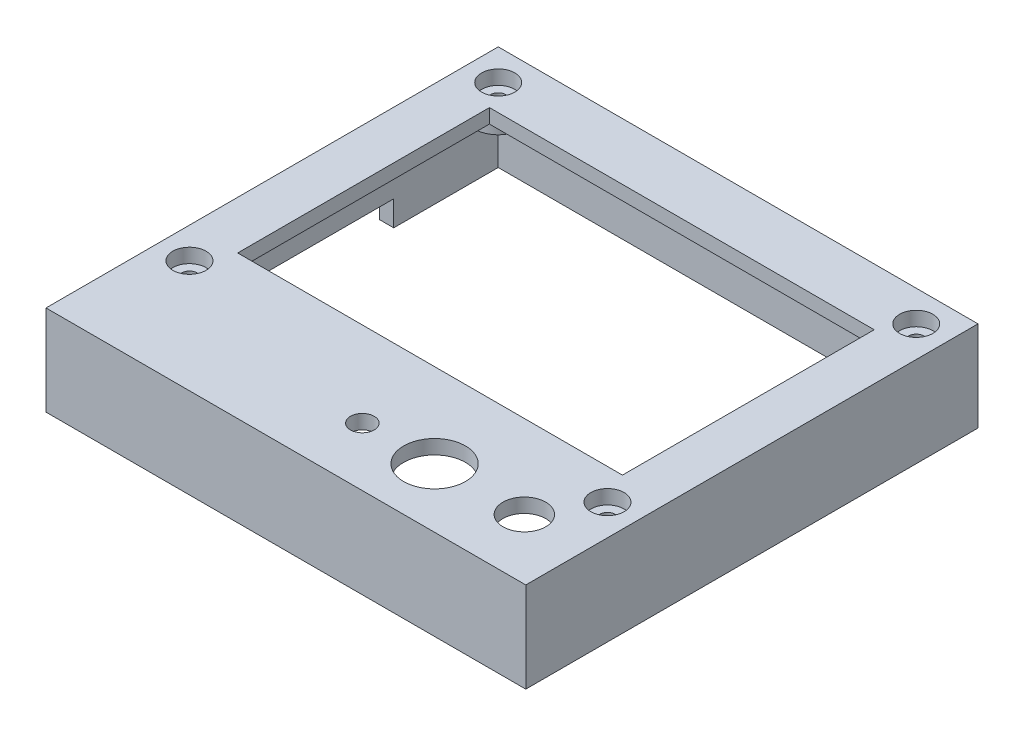
from build123d import *

# Parameters (mm, degrees)
SKETCH1_W           = 101
SKETCH1_H           = 95.2
BOSS_EXTRUDE1_DEPTH = 19
SHELL1_T            = -3
SKETCH3_R           = 5
BOSS_EXTRUDE2_DEPTH = 4
SKETCH4_R           = 1.6
CUT_EXTRUDE2_DEPTH  = 22
SKETCH6_W           = 28.5
SKETCH6_H           = 5.3
CUT_EXTRUDE3_DEPTH  = 22
SKETCH2_R           = 3.5
SKETCH2_R_2         = 4.5
SKETCH2_R_3         = 6.5
SKETCH2_R_4         = 2.5
SKETCH2_W           = 81
SKETCH2_H           = 53
CUT_EXTRUDE5_DEPTH  = 3


with BuildPart() as part:
    # Sketch1 → Boss-Extrude1 (new body)
    with BuildSketch(Plane(origin=(0, 0, 0), x_dir=(1, 0, 0), z_dir=(0, 1, 0))):
        with Locations((-43.75, 40.85)):
            Rectangle(SKETCH1_W, SKETCH1_H)
    extrude(amount=BOSS_EXTRUDE1_DEPTH)

    # Shell1
    shell1_openings = [part.faces().sort_by_distance(p)[0] for p in [
        (-43.75, 0, -40.85),
    ]]
    offset(amount=SHELL1_T, openings=shell1_openings, kind=Kind.INTERSECTION)

    # Sketch3 → Boss-Extrude2 (add)
    with BuildSketch(Plane.XZ.offset(-16)):
        with Locations((1.25, -82.95)):
            Circle(SKETCH3_R)
        with Locations((-88.75, -82.95)):
            Circle(SKETCH3_R)
        with Locations((-88.75, -17.95)):
            Circle(SKETCH3_R)
        with Locations((1.25, -17.95)):
            Circle(SKETCH3_R)
    extrude(amount=BOSS_EXTRUDE2_DEPTH)

    # Sketch4 → Cut-Extrude2 (cut)
    with BuildSketch(Plane.XZ.offset(-12)):
        with Locations(Location((0.25, -16.95, 0), (0, 0, 270))):
            Circle(SKETCH4_R)
        with Locations(Location((-87.75, -16.95, 0), (0, 0, 270))):
            Circle(SKETCH4_R)
        with Locations(Location((-87.75, -81.95, 0), (0, 0, 270))):
            Circle(SKETCH4_R)
        with Locations(Location((0.25, -81.95, 0), (0, 0, 270))):
            Circle(SKETCH4_R)
    extrude(amount=-CUT_EXTRUDE2_DEPTH, mode=Mode.SUBTRACT)

    # Sketch6 → Cut-Extrude3 (cut)
    with BuildSketch(Plane.ZY.offset(94.25)):
        with Locations((-49.2, 2.65)):
            Rectangle(SKETCH6_W, SKETCH6_H)
    extrude(amount=-CUT_EXTRUDE3_DEPTH, mode=Mode.SUBTRACT)

    # Sketch2 → Cut-Extrude5 (cut)
    with BuildSketch(Plane(origin=(0, 19, 0), x_dir=(1, 0, 0), z_dir=(0, 1, 0))):
        with Locations(Location((-87.75, 81.95, 0), (0, 0, 270))):
            Circle(SKETCH2_R)
        with Locations(Location((0.25, 81.95, 0), (0, 0, 270))):
            Circle(SKETCH2_R)
        with Locations(Location((-87.75, 16.95, 0), (0, 0, 270))):
            Circle(SKETCH2_R)
        with Locations(Location((0.25, 16.95, 0), (0, 0, 270))):
            Circle(SKETCH2_R)
        with Locations(Location((-6.25, 5.95, 0), (0, 0, 270))):
            Circle(SKETCH2_R_2)
        with Locations(Location((-24.95, 5.75, 0), (0, 0, 270))):
            Circle(SKETCH2_R_3)
        with Locations(Location((-39.95, 5.55, 0), (0, 0, 270))):
            Circle(SKETCH2_R_4)
        with Locations((-43.6, 49.95)):
            Rectangle(SKETCH2_W, SKETCH2_H)
    extrude(amount=-CUT_EXTRUDE5_DEPTH, mode=Mode.SUBTRACT)


solid = part.part
